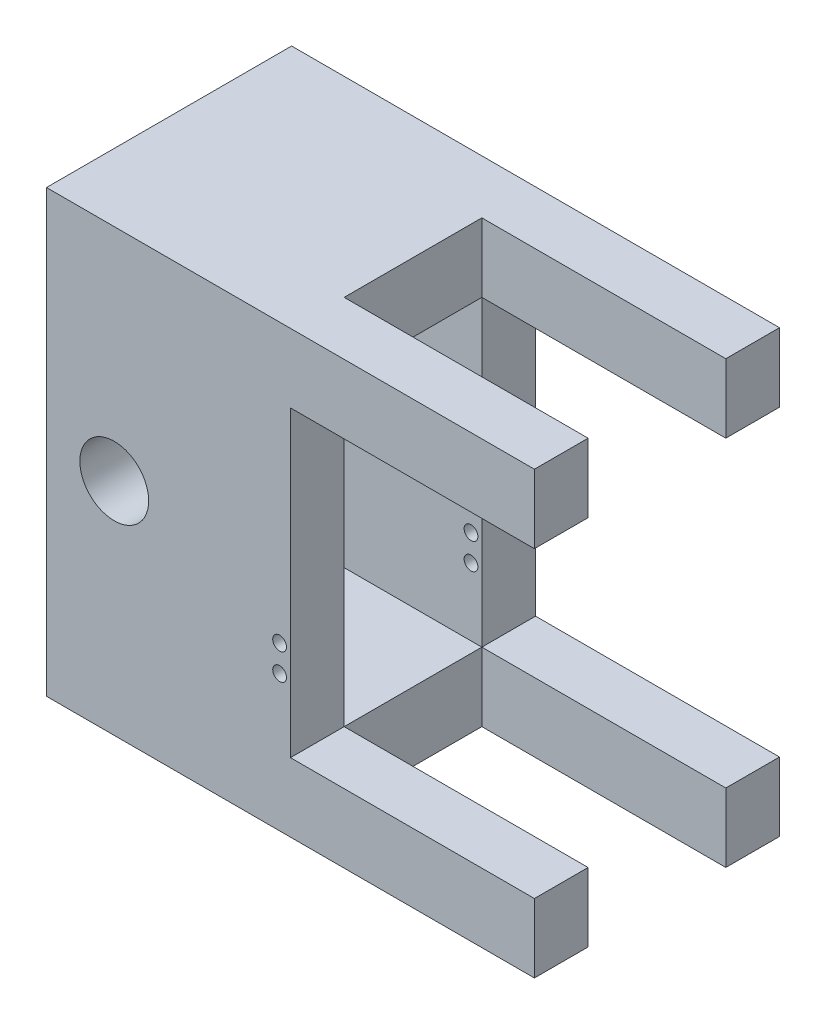
from build123d import *

# Parameters (mm, degrees)
SKETCH1_W             = 12.7
SKETCH1_H             = 9.906
BOSS_EXTRUDE1_DEPTH   = 90
BOSS_EXTRUDE1_2_DEPTH = 90
BOSS_EXTRUDE1_3_DEPTH = 90
BOSS_EXTRUDE1_4_DEPTH = 90
SKETCH1_4_W           = 55.88
SKETCH1_4_H           = 9.906
SKETCH1_4_W_2         = 12.7
SKETCH1_4_H_2         = 25.4
BOSS_EXTRUDE2_DEPTH   = 45
SKETCH1_5_W           = 55.88
SKETCH1_5_H           = 25.4
BOSS_EXTRUDE3_DEPTH   = 5
SKETCH3_R             = 1.27
SKETCH3_R_2           = 6.35
CUT_EXTRUDE1_DEPTH    = 130.423967425


with BuildPart() as part:
    # Sketch1 → Boss-Extrude1 (new body)
    with BuildSketch(Plane.YZ):
        with Locations((6.35, 40.259)):
            Rectangle(SKETCH1_W, SKETCH1_H)
    extrude(amount=BOSS_EXTRUDE1_DEPTH)



with BuildPart() as body_2:
    # Sketch1 → Boss-Extrude1 2 (new body)
    with BuildSketch(Plane.YZ):
        with Locations((74.93, 40.259)):
            Rectangle(SKETCH1_W, SKETCH1_H)
    extrude(amount=BOSS_EXTRUDE1_2_DEPTH)


with BuildPart() as body_3:
    # Sketch1 → Boss-Extrude1 3 (new body)
    with BuildSketch(Plane.YZ):
        with Locations((6.35, 4.953)):
            Rectangle(SKETCH1_W, SKETCH1_H)
    extrude(amount=BOSS_EXTRUDE1_3_DEPTH)


with BuildPart() as body_4:
    # Sketch1 → Boss-Extrude1 4 (new body)
    with BuildSketch(Plane.YZ):
        with Locations((74.93, 4.953)):
            Rectangle(SKETCH1_W, SKETCH1_H)
    extrude(amount=BOSS_EXTRUDE1_4_DEPTH)


with BuildPart() as part_1:
    add(part.part)

    add(body_2.part)  # Boss-Extrude2 merges body 2

    add(body_3.part)  # Boss-Extrude2 merges body 3

    add(body_4.part)  # Boss-Extrude2 merges body 4
    # Sketch1<4> → Boss-Extrude2 (add)
    with BuildSketch(Plane.YZ):
        with Locations((40.64, 40.259)):
            Rectangle(SKETCH1_4_W, SKETCH1_4_H)
        with Locations((6.35, 22.606)):
            Rectangle(SKETCH1_4_W_2, SKETCH1_4_H_2)
        with Locations((40.64, 4.953)):
            Rectangle(SKETCH1_4_W, SKETCH1_4_H)
        with Locations((74.93, 22.606)):
            Rectangle(SKETCH1_4_W_2, SKETCH1_4_H_2)
    extrude(amount=BOSS_EXTRUDE2_DEPTH)

    # Sketch1<5> → Boss-Extrude3 (add)
    with BuildSketch(Plane.YZ):
        with Locations((40.64, 22.606)):
            Rectangle(SKETCH1_5_W, SKETCH1_5_H)
    extrude(amount=BOSS_EXTRUDE3_DEPTH)

    # Sketch3 → Cut-Extrude1 (cut, through all)
    with BuildSketch(Plane.XY.offset(45.212)):
        with Locations((43, 30)):
            Circle(SKETCH3_R)
        with Locations((43, 25.1359)):
            Circle(SKETCH3_R)
        with Locations((12.5, 40.64)):
            Circle(SKETCH3_R_2)
    extrude(amount=-CUT_EXTRUDE1_DEPTH, mode=Mode.SUBTRACT)


solid = part_1.part
